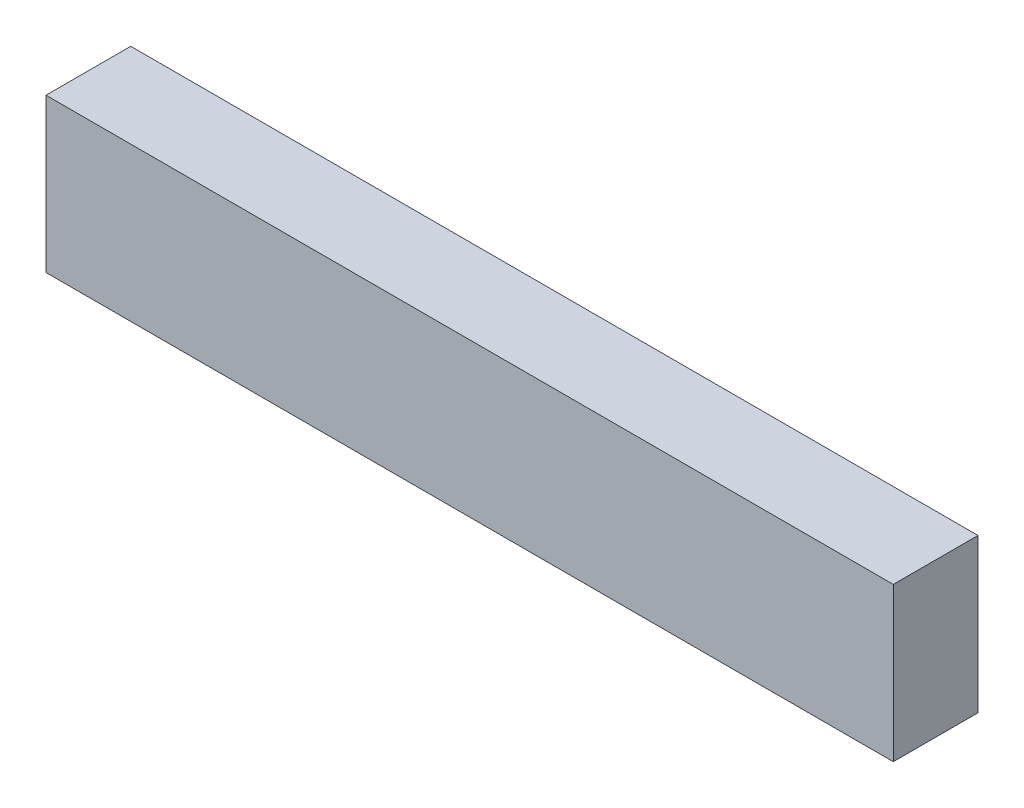
from build123d import *

# Parameters (mm, degrees)
SKETCH1_W           = 80
SKETCH1_H           = 8
BOSS_EXTRUDE1_DEPTH = 14.5


with BuildPart() as part:
    # Sketch1 → Boss-Extrude1 (new body)
    with BuildSketch(Plane(origin=(0, 0, 0), x_dir=(1, 0, 0), z_dir=(0, 1, 0))):
        Rectangle(SKETCH1_W, SKETCH1_H)
    extrude(amount=BOSS_EXTRUDE1_DEPTH)


solid = part.part
